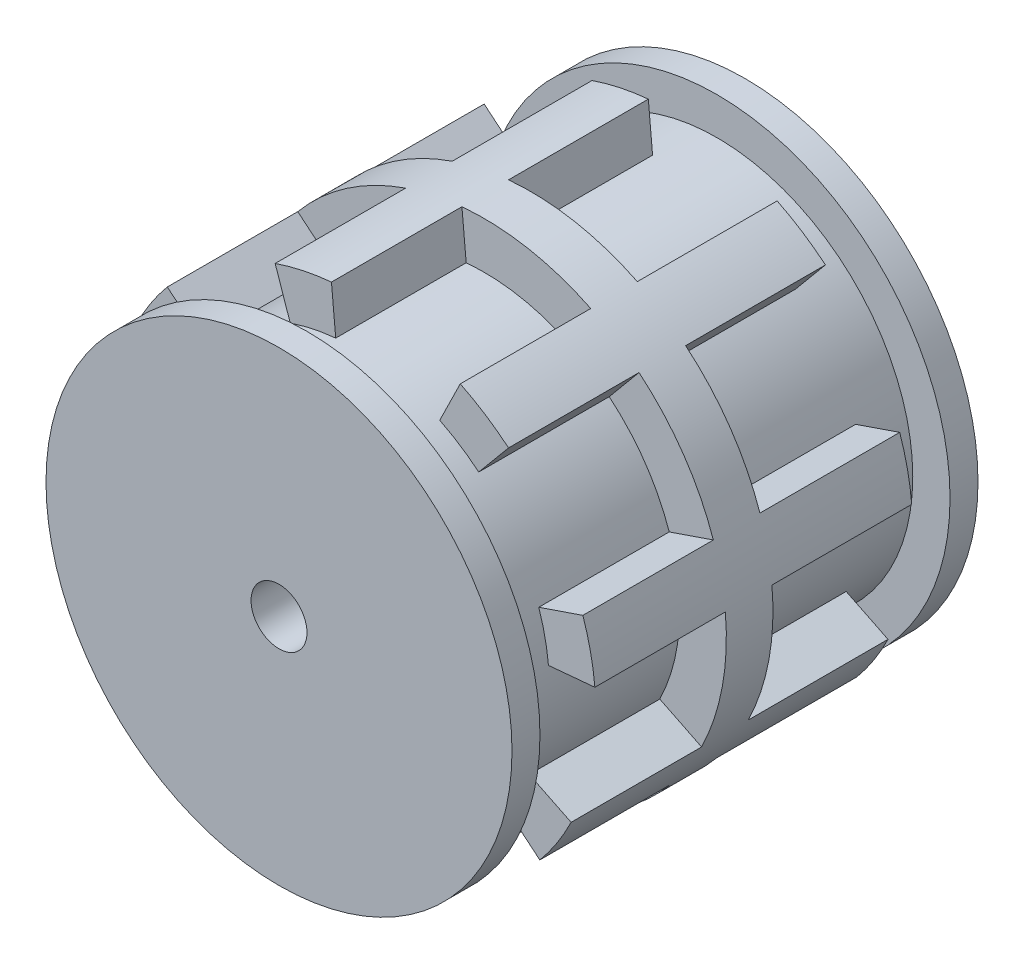
from build123d import *
from build123d.topology import SkipClean

# Parameters (mm, degrees)
CROQUIS1_R              = 12.5
SALIENTE_EXTRUIR1_DEPTH = 25
CROQUIS2_W              = 22
CROQUIS2_H              = 2
CROQUIS3_R              = 1.5
CORTAR_EXTRUIR1_DEPTH   = 25
ENVOLVER1_SECTION_W     = 2.5
ENVOLVER1_SECTION_H     = 17
ENVOLVER1_ANGLE         = 13.641852265
MATRIZC1_COUNT          = 8
CROQUIS5_W              = 2.5
CROQUIS5_H              = 2.5


with BuildPart() as part:
    # Croquis1 → Saliente-Extruir1 (new body)
    with BuildSketch(Plane.XY):
        Circle(CROQUIS1_R)
    extrude(amount=SALIENTE_EXTRUIR1_DEPTH)

    # Croquis2 → Cortar-Revolución1 (revolve, cut)
    with BuildSketch(Plane(origin=(0, 0, 0), x_dir=(0, 0, -1), z_dir=(1, 0, 0)), mode=Mode.PRIVATE) as cortar_revoluci_n1_sk:
        with Locations((-12.5, 11.5)):
            Rectangle(CROQUIS2_W, CROQUIS2_H)
    revolve(cortar_revoluci_n1_sk.sketch.rotate(Axis((0, 0, 31.879564167), (0, 0, -1)), 90), axis=Axis((0, 0, 31.879564167), (0, 0, -1)), mode=Mode.SUBTRACT)

    # Croquis3 → Cortar-Extruir1 (cut)
    with BuildSketch(Plane.XY.offset(25)):
        Circle(CROQUIS3_R)
    extrude(amount=-CORTAR_EXTRUIR1_DEPTH, mode=Mode.SUBTRACT)

    # Envolver1 section (on wrap section) → Envolver1 (revolve)
    with BuildSketch(Plane(origin=(0, 0, 1.5), x_dir=(0.9958286703068172, 0.09124285941900567, 0), z_dir=(0.09124285941900567, -0.9958286703068172, 0))):
        with Locations((11.75, 11)):
            Rectangle(ENVOLVER1_SECTION_W, ENVOLVER1_SECTION_H)
    envolver1 = revolve(axis=Axis((0, 0, 1.5), (0, 0, 1)), revolution_arc=ENVOLVER1_ANGLE)

    # MatrizC1: Envolver1 ×8 about axis
    matrizc1_axis = Axis((0, 0, 0), (0, 0, 1))
    for i in range(1, MATRIZC1_COUNT):
        add(envolver1.rotate(matrizc1_axis, i * 360 / MATRIZC1_COUNT))

    # Croquis5 → Revolución1 (revolve)
    with SkipClean():  # the faces are left unmerged after this step: merging them gives an invalid solid
        with BuildSketch(Plane(origin=(0, 0, 0), x_dir=(1, 0, 0), z_dir=(0, 1, 0))):
            with Locations((11.75, -12.75)):
                Rectangle(CROQUIS5_W, CROQUIS5_H)
        revolve(axis=Axis((0, 0, -6.443168791), (0, 0, 1)))


solid = part.part
